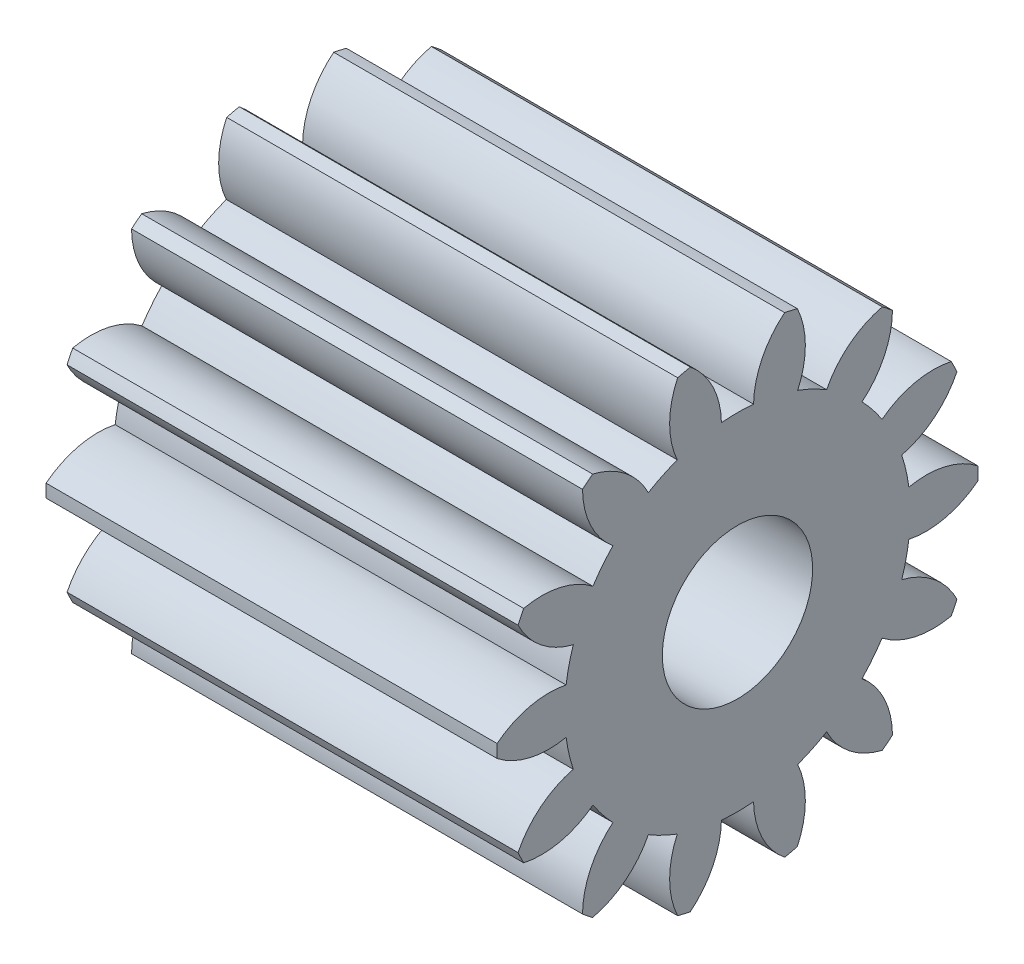
from build123d import *

# Parameters (mm, degrees)
BASPROSKE_W     = 30
BASPROSKE_H     = 16
TOOTHCUT_DEPTH  = 38.576588456
TEETHCUTS_COUNT = 14
TEETHCUTS_ANGLE = 334.285714286
BORSKE_R        = 5
BORE_DEPTH      = 50.0000508


with BuildPart() as part:
    # BasProSke → Base-Revolve (revolve)
    with BuildSketch(Plane(origin=(0, 0, 0), x_dir=(1, 0, 0), z_dir=(0, 1, 0)), mode=Mode.PRIVATE) as base_revolve_sk:
        with Locations((15, 8)):
            Rectangle(BASPROSKE_W, BASPROSKE_H)
    revolve(base_revolve_sk.sketch.rotate(Axis((-10, 0, 0), (1, 0, 0)), 180), axis=Axis((-10, 0, 0), (1, 0, 0)))

    # TooCutSke → ToothCut (cut, through all)
    with BuildSketch(Plane(origin=(0, 0, 0), x_dir=(0, 0, -1), z_dir=(1, 0, 0))):
        with BuildLine():
            ThreePointArc((1.067858192, 11.449309144), (0, 11.499), (-1.067858192, 11.449309144))
            ThreePointArc((-1.067858192, 11.449309144), (-1.641684211, 13.812780716), (-3.163375005, 15.710076503))
            ThreePointArc((-3.163375005, 15.710076503), (0, 16.0254), (3.163375005, 15.710076503))
            ThreePointArc((3.163375005, 15.710076503), (1.641684211, 13.812780716), (1.067858192, 11.449309144))
        make_face()
    toothcut = extrude(amount=TOOTHCUT_DEPTH, mode=Mode.SUBTRACT)

    # TeethCuts: ToothCut ×14 about axis
    teethcuts_axis = Axis((-10, 0, 0), (1, 0, 0))
    for i in range(1, TEETHCUTS_COUNT):
        add(toothcut.rotate(teethcuts_axis, i * TEETHCUTS_ANGLE / (TEETHCUTS_COUNT - 1)), mode=Mode.SUBTRACT)

    # BorSke → Bore (cut, symmetric)
    with BuildSketch(Plane(origin=(0, 0, 0), x_dir=(0, 0, -1), z_dir=(1, 0, 0))):
        with Locations(Location((0, 0, 0), (0, 0, 180))):
            Circle(BORSKE_R)
    extrude(amount=BORE_DEPTH, both=True, mode=Mode.SUBTRACT)


solid = part.part
